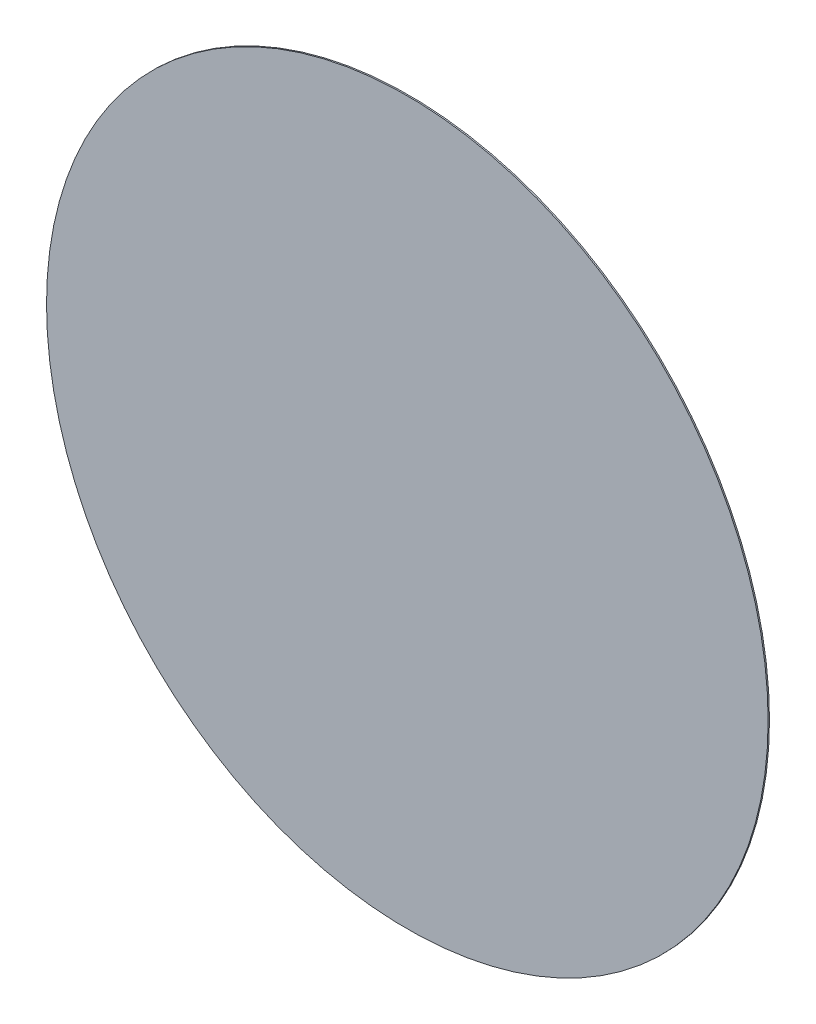
from build123d import *

# Parameters (mm, degrees)
ESQUISSE1_R        = 13.3
BOSS_EXTRU_1_DEPTH = 0.05


with BuildPart() as part:
    # Esquisse1 → Boss.-Extru.1 (new body)
    with BuildSketch(Plane.XY):
        Circle(ESQUISSE1_R)
    extrude(amount=BOSS_EXTRU_1_DEPTH)


solid = part.part
